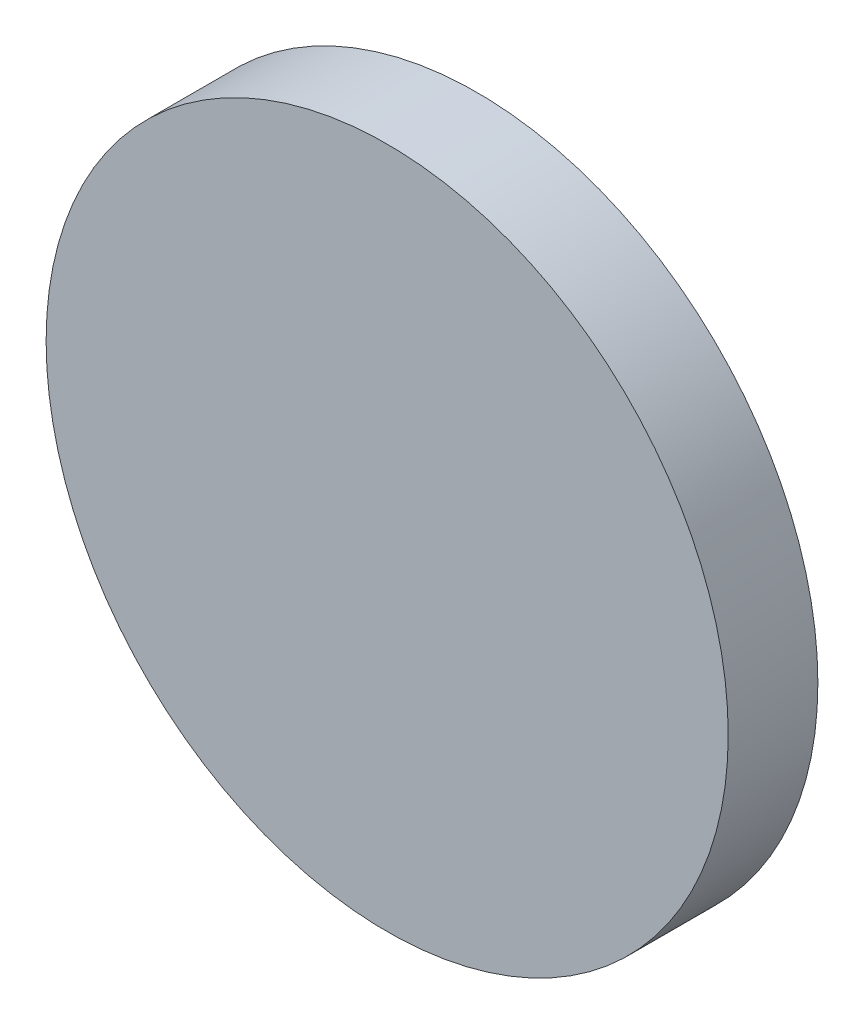
from build123d import *

# Parameters (mm, degrees)
SKETCH1_R           = 12.0777
BOSS_EXTRUDE1_DEPTH = 3.175


with BuildPart() as part:
    # Sketch1 → Boss-Extrude1 (new body)
    with BuildSketch(Plane.XY):
        Circle(SKETCH1_R)
    extrude(amount=BOSS_EXTRUDE1_DEPTH)


solid = part.part
